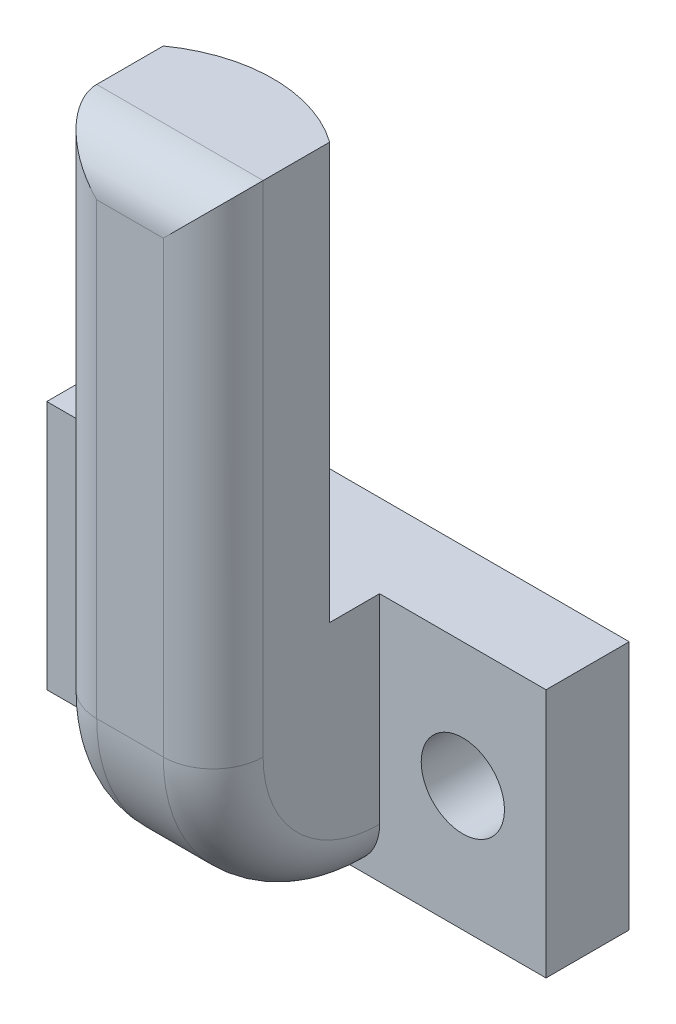
from build123d import *

# Parameters (mm, degrees)
ESQUISSE1_W        = 30
ESQUISSE1_H        = 15
ESQUISSE1_R        = 2.5
BOSS_EXTRU_2_DEPTH = 5
ESQUISSE2_W        = 10
ESQUISSE2_H        = 15
BOSS_EXTRU_3_DEPTH = 10
BOSS_EXTRU_5_DEPTH = 25
CONG_1_R           = 10
CONG_2_R           = 3


with BuildPart() as part:
    # Esquisse1 → Boss.-Extru.2 (new body)
    with BuildSketch(Plane.XY):
        Rectangle(ESQUISSE1_W, ESQUISSE1_H)
        with Locations((-10, 0)):
            Circle(ESQUISSE1_R, mode=Mode.SUBTRACT)
        with Locations(Location((10, 0, 0), (0, 0, 180))):
            Circle(ESQUISSE1_R, mode=Mode.SUBTRACT)
    extrude(amount=BOSS_EXTRU_2_DEPTH)

    # Esquisse2 → Boss.-Extru.3 (add)
    with BuildSketch(Plane.XY.offset(5)):
        Rectangle(ESQUISSE2_W, ESQUISSE2_H)
    extrude(amount=BOSS_EXTRU_3_DEPTH)

    # Esquisse3 → Boss.-Extru.5 (add)
    with BuildSketch(Plane(origin=(0, 7.5, 0), x_dir=(1, 0, 0), z_dir=(0, 1, 0))):
        with BuildLine():
            ThreePointArc((5, -8), (0, -6.397674733), (-5, -8))
            Line((-5, -8), (-5, -15))
            Line((-5, -15), (5, -15))
            Line((5, -15), (5, -8))
        make_face()
    extrude(amount=BOSS_EXTRU_5_DEPTH)

    # Congé1
    cong_1_edges = [part.edges().sort_by_distance(p)[0] for p in [
        (0, -7.5, 15),
    ]]
    fillet(cong_1_edges, radius=CONG_1_R)

    # Congé2
    cong_2_edges = [part.edges().sort_by_distance(p)[0] for p in [
        (-5, 17.5, 15),
        (0, 32.5, 15),
        (5, 17.5, 15),
        (5, -4.571067812, 12.071067812),
        (-5, -4.571067812, 12.071067812),
    ]]
    fillet(cong_2_edges, radius=CONG_2_R)


solid = part.part
